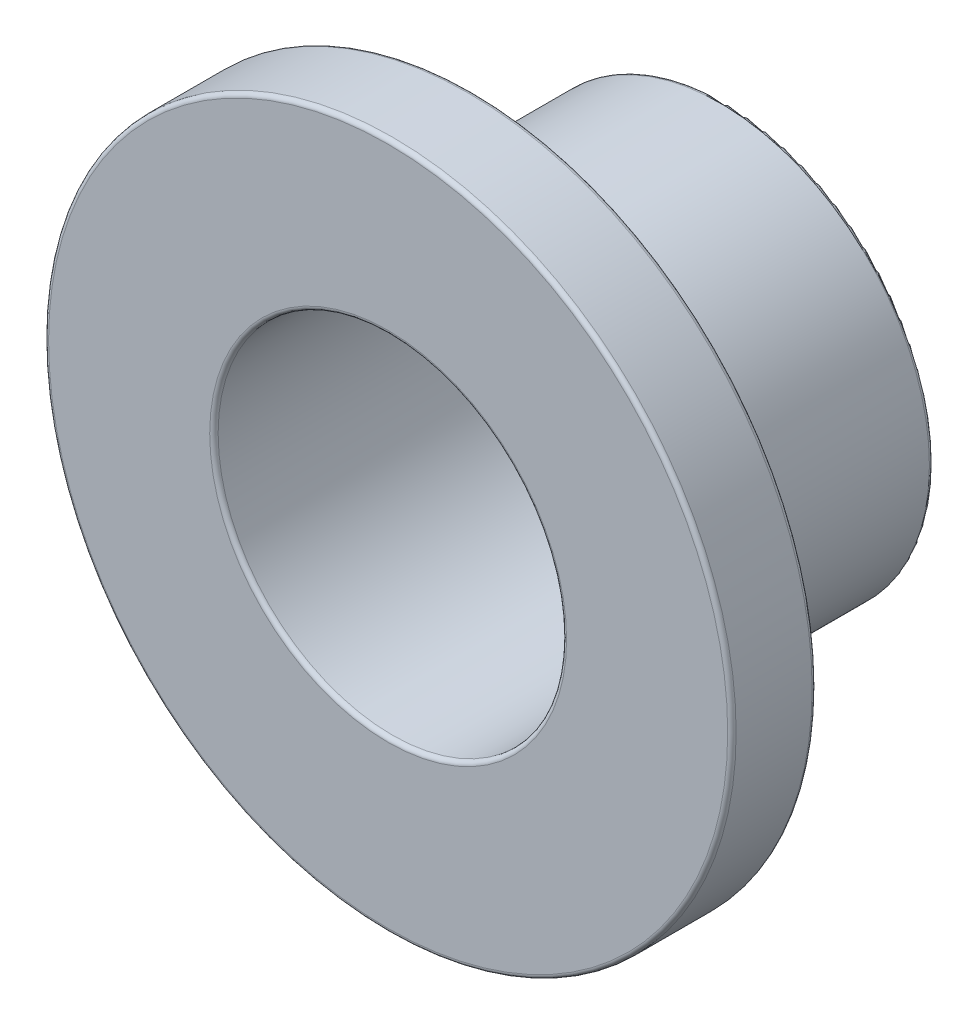
from build123d import *

# Parameters (mm, degrees)
FILLET1_R = 0.08001


with BuildPart() as part:
    # Sketch2 → Revolve1 (revolve)
    with BuildSketch(Plane(origin=(0, 0, 0), x_dir=(0, 0, -1), z_dir=(1, 0, 0)), mode=Mode.PRIVATE) as revolve1_sk:
        Polygon((-3.1877, 3.302), (3.1877, 3.302), (3.1877, 3.9624), (-1.5875, 3.9624), (-1.5875, 6.5151), (-3.1877, 6.5151), align=None)
    revolve(revolve1_sk.sketch.rotate(Axis((0, 0, 3.1877), (0, 0, -1)), 90), axis=Axis((0, 0, 3.1877), (0, 0, -1)))

    # Fillet1
    fillet1_edges = [part.edges().sort_by_distance(p)[0] for p in [
        (-6.5151, 0, 3.1877),
        (-6.5151, 0, 1.5875),
        (-3.9624, 0, 1.5875),
        (-3.9624, 0, -3.1877),
        (-3.302, 0, -3.1877),
        (-3.302, 0, 3.1877),
    ]]
    fillet(fillet1_edges, radius=FILLET1_R)


solid = part.part
